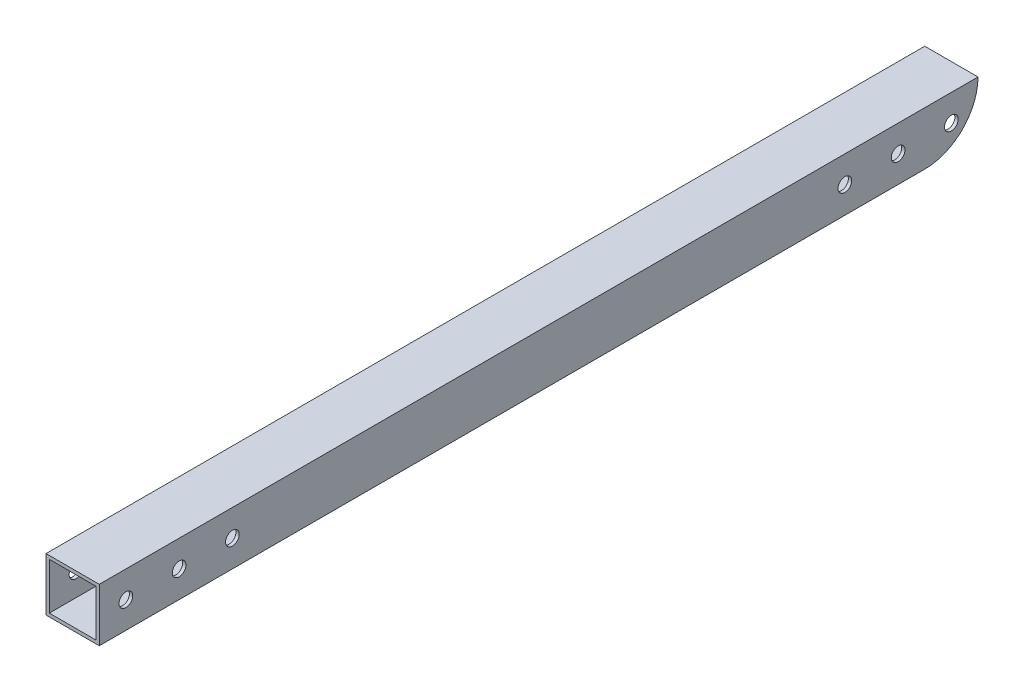
from build123d import *

# Parameters (mm, degrees)
SKETCH1_W           = 25.4
SKETCH1_H           = 25.4
SKETCH1_W_2         = 22.225
SKETCH1_H_2         = 22.225
BOSS_EXTRUDE1_DEPTH = 419.1
SKETCH2_R           = 3.2639
CUT_EXTRUDE1_DEPTH  = 421.636577107
CUT_EXTRUDE2_DEPTH  = 421.636577107


with BuildPart() as part:
    # Sketch1 → Boss-Extrude1 (new body)
    with BuildSketch(Plane.XY):
        with Locations((12.7, 12.7)):
            Rectangle(SKETCH1_W, SKETCH1_H)
        with Locations((12.7, 12.7)):
            Rectangle(SKETCH1_W_2, SKETCH1_H_2, mode=Mode.SUBTRACT)
    extrude(amount=BOSS_EXTRUDE1_DEPTH)

    # Sketch2 → Cut-Extrude1 (cut, through all)
    with BuildSketch(Plane.ZY):
        with Locations((12.7, 12.7)):
            Circle(SKETCH2_R)
        with Locations((38.1, 12.7)):
            Circle(SKETCH2_R)
        with Locations((63.5, 12.7)):
            Circle(SKETCH2_R)
        with Locations(Location((355.6, 12.7, 0), (0, 0, 270))):
            Circle(SKETCH2_R)
        with Locations(Location((381, 12.7, 0), (0, 0, 270))):
            Circle(SKETCH2_R)
        with Locations(Location((406.4, 12.7, 0), (0, 0, 270))):
            Circle(SKETCH2_R)
    extrude(amount=-CUT_EXTRUDE1_DEPTH, mode=Mode.SUBTRACT)

    # Sketch3 → Cut-Extrude2 (cut, through all)
    with BuildSketch(Plane(origin=(25.4, 0, 0), x_dir=(0, 0, -1), z_dir=(1, 0, 0))):
        with BuildLine():
            Line((0, 25.4), (0, 0))
            Line((0, 0), (-25.4, 0))
            ThreePointArc((-25.4, 0), (-7.439487758, 7.439487758), (0, 25.4))
        make_face()
    extrude(amount=-CUT_EXTRUDE2_DEPTH, mode=Mode.SUBTRACT)


solid = part.part
